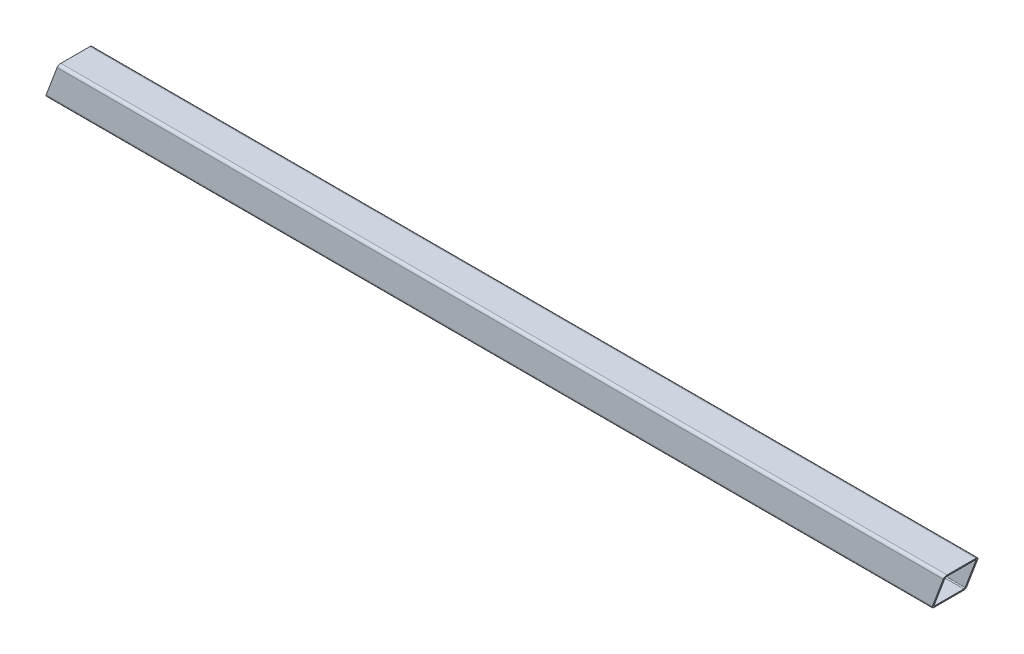
from build123d import *

# Parameters (mm, degrees)
BOSS_EXTRUDE1_DEPTH = 1320.8
SCALE2_SCALE_X      = 1
SCALE2_SCALE_Y      = 0.4
SCALE2_SCALE_Z      = 0.4
CUT_EXTRUDE1_DEPTH  = 1322.04802369
CUT_EXTRUDE2_DEPTH  = 1322.04802369


with BuildPart() as part:
    # Sketch1 → Boss-Extrude1 (new body)
    with BuildSketch(Plane(origin=(0, 0, 0), x_dir=(0, 0, -1), z_dir=(1, 0, 0))):
        with BuildLine():
            Line((0, 2.54), (0, 29.21))
            ThreePointArc((0, 29.21), (-0.743948776, 31.006051224), (-2.54, 31.75))
            Line((-2.54, 31.75), (-29.21, 31.75))
            ThreePointArc((-29.21, 31.75), (-31.006051224, 31.006051224), (-31.75, 29.21))
            Line((-31.75, 29.21), (-31.75, 2.54))
            ThreePointArc((-31.75, 2.54), (-31.006051224, 0.743948776), (-29.21, 0))
            Line((-29.21, 0), (-2.54, 0))
            ThreePointArc((-2.54, 0), (-0.743948776, 0.743948776), (0, 2.54))
        make_face()
        with BuildLine():
            Line((-1.651, 2.54), (-1.651, 29.21))
            ThreePointArc((-1.651, 29.21), (-1.911382072, 29.838617928), (-2.54, 30.099))
            Line((-2.54, 30.099), (-29.21, 30.099))
            ThreePointArc((-29.21, 30.099), (-29.838617928, 29.838617928), (-30.099, 29.21))
            Line((-30.099, 29.21), (-30.099, 2.54))
            ThreePointArc((-30.099, 2.54), (-29.838617928, 1.911382072), (-29.21, 1.651))
            Line((-29.21, 1.651), (-2.54, 1.651))
            ThreePointArc((-2.54, 1.651), (-1.911382072, 1.911382072), (-1.651, 2.54))
        make_face(mode=Mode.SUBTRACT)
    extrude(amount=BOSS_EXTRUDE1_DEPTH)


with BuildPart() as part_1:
    # Scale2: scaled about (660.4, 15.875, 15.875)
    add(part.part.scale((SCALE2_SCALE_X, SCALE2_SCALE_Y, SCALE2_SCALE_Z), about=(660.4, 15.875, 15.875)))

    # Sketch3 → Cut-Extrude1 (cut, through all)
    with BuildSketch(Plane.XY.offset(22.225)):
        Polygon((896.669001333, 22.225), (891.922323592, 9.525), (863.555279379, 9.525), (863.555279379, 22.225), align=None)
    extrude(amount=-CUT_EXTRUDE1_DEPTH, mode=Mode.SUBTRACT)


with BuildPart() as cut_extrude1_kept_piece:
    # of the separate pieces the step leaves, the one the design keeps (cut_extrude1_pieces_kept)
    add(part_1.part.solids().sort_by_distance((896.289267114, 21.209, 9.525))[0])

    # Sketch4 → Cut-Extrude2 (cut, through all)
    with BuildSketch(Plane.XY.offset(22.225)):
        Polygon((1217.31572696, 9.525), (1320.8, 9.525), (1320.8, 22.225), (1222.062404701, 22.225), align=None)
    extrude(amount=-CUT_EXTRUDE2_DEPTH, mode=Mode.SUBTRACT)


solid = cut_extrude1_kept_piece.part
